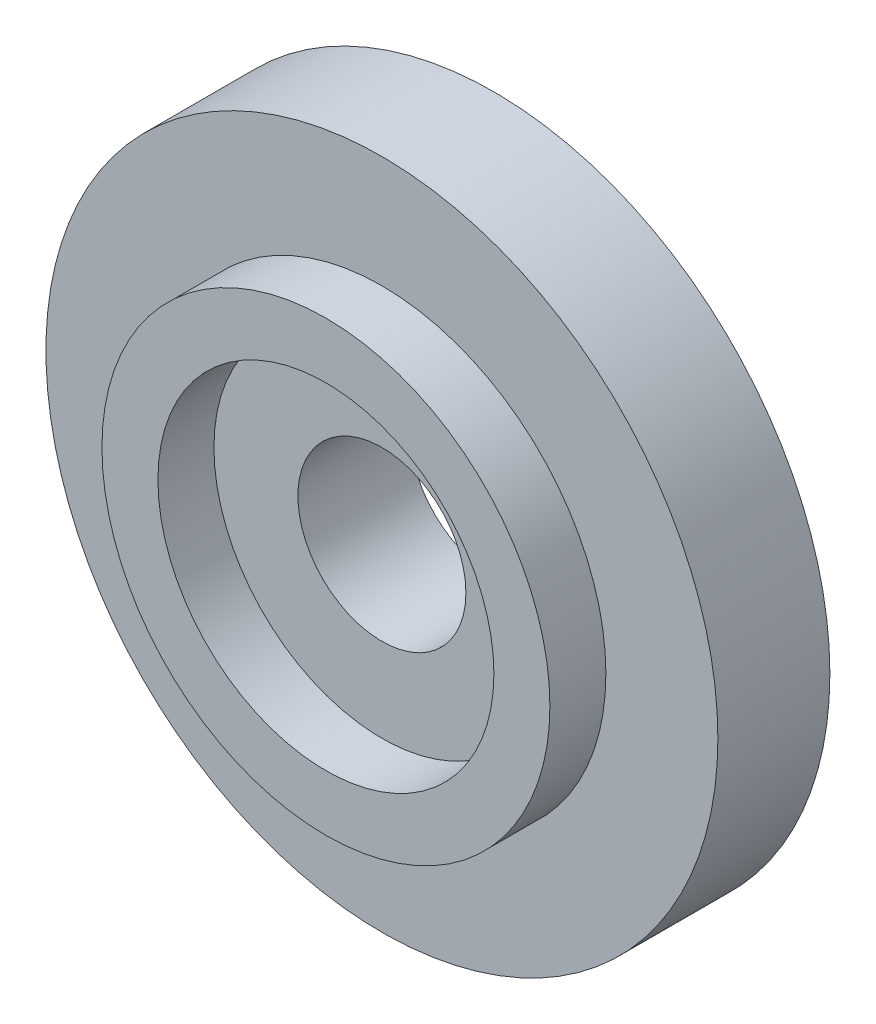
from build123d import *

# Parameters (mm, degrees)
SKETCH1_R           = 6
SKETCH1_R_2         = 1.5
BOSS_EXTRUDE1_DEPTH = 2
SKETCH2_R           = 4
SKETCH2_R_2         = 3
BOSS_EXTRUDE2_DEPTH = 1


with BuildPart() as part:
    # Sketch1 → Boss-Extrude1 (new body)
    with BuildSketch(Plane.XY):
        Circle(SKETCH1_R)
        Circle(SKETCH1_R_2, mode=Mode.SUBTRACT)
    extrude(amount=BOSS_EXTRUDE1_DEPTH)

    # Sketch2 → Boss-Extrude2 (add)
    with BuildSketch(Plane.XY.offset(2)):
        Circle(SKETCH2_R)
        Circle(SKETCH2_R_2, mode=Mode.SUBTRACT)
    extrude(amount=BOSS_EXTRUDE2_DEPTH)


solid = part.part
